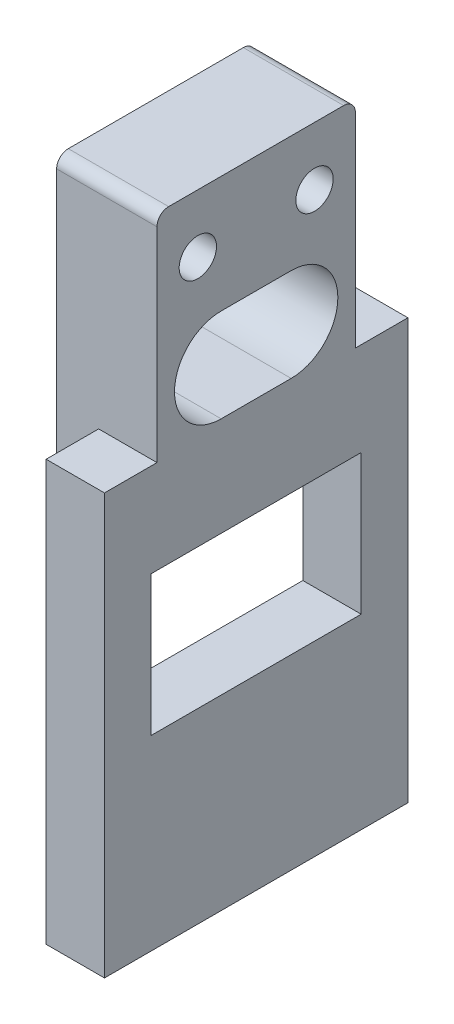
from build123d import *

# Parameters (mm, degrees)
BOSS_EXTRUDE1_START      = 3.6
SKETCH2_W                = 22
SKETCH2_H                = 28
SKETCH2_W_2              = 18
SKETCH2_H_2              = 12
SKETCH2_W_3              = 4.5
SKETCH2_H_3              = 5
SKETCH2_W_4              = 17
BOSS_EXTRUDE1_DEPTH      = 5
SKETCH2_3_W              = 17
SKETCH2_3_H              = 5
BOSS_EXTRUDE2_DEPTH      = 8.6
SKETCH2_7_W              = 17
SKETCH2_7_H              = 18.5
BOSS_EXTRUDE3_DEPTH      = 8.6
M3_CLEARANCE_HOLE1_D     = 3.2
M3_CLEARANCE_HOLE1_DEPTH = 5
M3_CLEARANCE_HOLE1_TIP   = 0.96137699
FILLET1_R                = 1


with BuildPart() as part:
    # Sketch2 → Boss-Extrude1 (new body)
    # profile 1 of 5: a face of its own
    with BuildSketch(Plane(origin=(0, 0, 0), x_dir=(0, 0, -1), z_dir=(1, 0, 0)).offset(BOSS_EXTRUDE1_START)):
        Polygon((-13, 22.5), (-8.5, 22.5), (8.5, 22.5), (13, 22.5), (13, -8.5), (-13, -8.5), align=None)
        with Locations((0, 6.5)):
            Rectangle(SKETCH2_W, SKETCH2_H, mode=Mode.SUBTRACT)
    # profile 2 of 5: a face of its own
    with BuildSketch(Plane(origin=(0, 0, 0), x_dir=(0, 0, -1), z_dir=(1, 0, 0)).offset(BOSS_EXTRUDE1_START)):
        with Locations((0, 6.5)):
            Rectangle(SKETCH2_W, SKETCH2_H)
        with Locations((0, 13.5)):
            Rectangle(SKETCH2_W_2, SKETCH2_H_2, mode=Mode.SUBTRACT)
    # profile 3 of 5: a face of its own
    with BuildSketch(Plane(origin=(0, 0, 0), x_dir=(0, 0, -1), z_dir=(1, 0, 0)).offset(BOSS_EXTRUDE1_START)):
        with Locations((10.75, 25)):
            Rectangle(SKETCH2_W_3, SKETCH2_H_3)
    # profile 4 of 5: a face of its own
    with BuildSketch(Plane(origin=(0, 0, 0), x_dir=(0, 0, -1), z_dir=(1, 0, 0)).offset(BOSS_EXTRUDE1_START)):
        with Locations((0, 25)):
            Rectangle(SKETCH2_W_4, SKETCH2_H_3)
    # profile 5 of 5: a face of its own
    with BuildSketch(Plane(origin=(0, 0, 0), x_dir=(0, 0, -1), z_dir=(1, 0, 0)).offset(BOSS_EXTRUDE1_START)):
        with Locations((-10.75, 25)):
            Rectangle(SKETCH2_W_3, SKETCH2_H_3)
    extrude(amount=BOSS_EXTRUDE1_DEPTH)

    # Sketch2<3> → Boss-Extrude2 (add)
    with BuildSketch(Plane(origin=(0, 0, 0), x_dir=(0, 0, -1), z_dir=(1, 0, 0))):
        with Locations((0, 25)):
            Rectangle(SKETCH2_3_W, SKETCH2_3_H)
    extrude(amount=BOSS_EXTRUDE2_DEPTH)

    # Sketch2<7> → Boss-Extrude3 (add)
    with BuildSketch(Plane(origin=(0, 0, 0), x_dir=(0, 0, -1), z_dir=(1, 0, 0))):
        with Locations((0, 36.75)):
            Rectangle(SKETCH2_7_W, SKETCH2_7_H)
        with BuildLine():
            Line((3, 28), (-3, 28))
            ThreePointArc((-3, 28), (-7, 32), (-3, 36))
            Line((-3, 36), (3, 36))
            ThreePointArc((3, 36), (7, 32), (3, 28))
        make_face(mode=Mode.SUBTRACT)
    extrude(amount=BOSS_EXTRUDE3_DEPTH)

    # M3 Clearance Hole1
    with Locations(Plane(origin=(8.6, 0, 0), x_dir=(0, 0, -1), z_dir=(1, 0, 0))):
        with Locations((-5, 41), (5, 41)):
            Hole(M3_CLEARANCE_HOLE1_D / 2, depth=M3_CLEARANCE_HOLE1_DEPTH)
            with Locations((0, 0, -(M3_CLEARANCE_HOLE1_DEPTH + M3_CLEARANCE_HOLE1_TIP / 2))):  # 118° drill point
                Cone(0, M3_CLEARANCE_HOLE1_D / 2, M3_CLEARANCE_HOLE1_TIP, mode=Mode.SUBTRACT)

    # Fillet1
    fillet1_edges = [part.edges().sort_by_distance(p)[0] for p in [
        (1.8, 22.5, 8.5),
        (1.8, 22.5, -8.5),
        (4.3, 46, -8.5),
        (4.3, 46, 8.5),
    ]]
    fillet(fillet1_edges, radius=FILLET1_R)


solid = part.part
